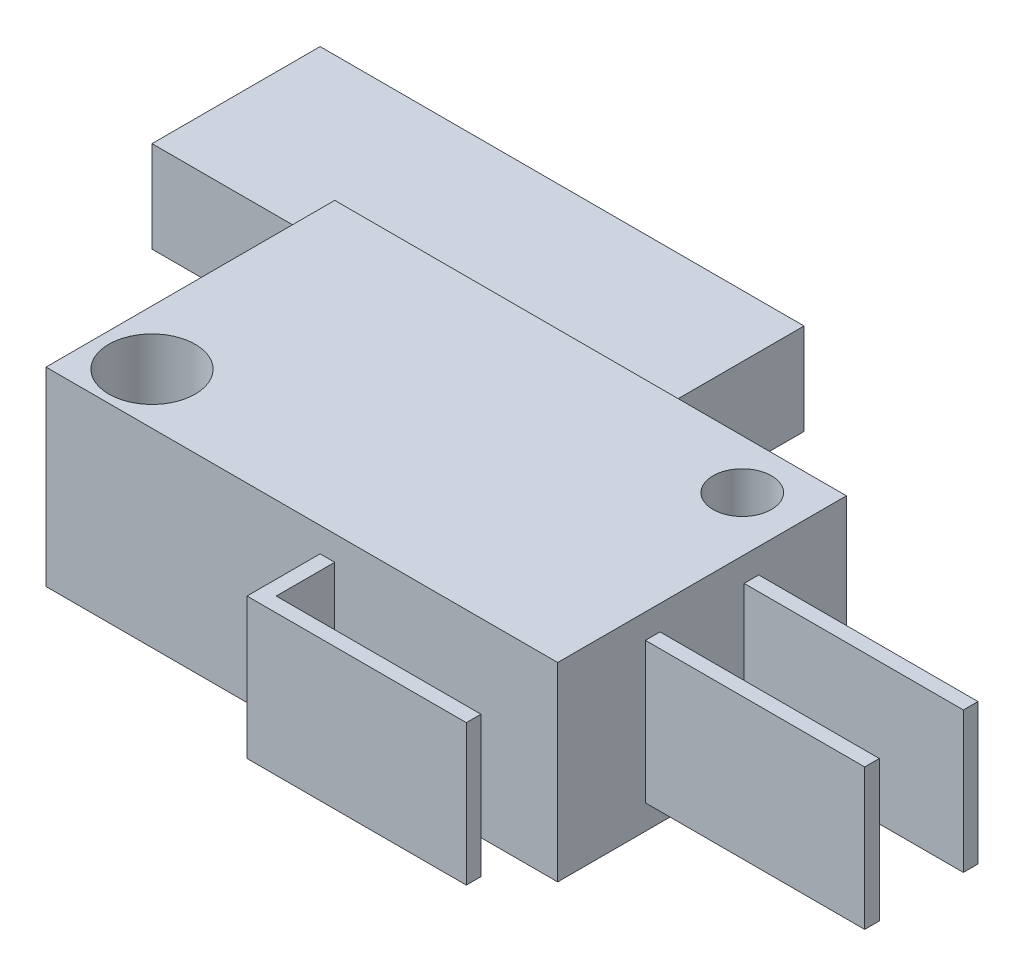
from build123d import *

# Parameters (mm, degrees)
SKETCH1_W                = 28
SKETCH1_H                = 15.8
BASE_DEPTH               = 10.4
SKETCH2_W                = 0.8
SKETCH2_H                = 7.7
END_PRONGS_DEPTH         = 12
SKETCH3_W                = 12
SKETCH3_H                = 7.7
SIDE_PRONG_EXTRUDE_DEPTH = 4
SKETCH4_W                = 11.2
SKETCH4_H                = 3.2
SIDE_PRONG_CUT_DEPTH     = 44.949317401
SKETCH6_R                = 1.6
SKETCH6_R_2              = 2.365004953
HOLES_DEPTH              = 45.247033799
SKETCH5_W                = 16.481894615
SKETCH5_H                = 5
BOSS_EXTRUDE4_DEPTH      = 9.2
SKETCH7_W                = 9.2
SKETCH7_H                = 5
BOSS_EXTRUDE5_DEPTH      = 10


with BuildPart() as part:
    # Sketch1 → Base (new body)
    with BuildSketch(Plane(origin=(0, 0, 0), x_dir=(1, 0, 0), z_dir=(0, 1, 0))):
        with Locations((14, 7.9)):
            Rectangle(SKETCH1_W, SKETCH1_H)
    extrude(amount=BASE_DEPTH)

    # Sketch2 → End Prongs (add)
    with BuildSketch(Plane(origin=(28, 0, 0), x_dir=(0, 0, -1), z_dir=(1, 0, 0))):
        with Locations((5.2, 5.2)):
            Rectangle(SKETCH2_W, SKETCH2_H)
        with Locations((10.6, 5.2)):
            Rectangle(SKETCH2_W, SKETCH2_H)
    extrude(amount=END_PRONGS_DEPTH)

    # Sketch3 → Side Prong Extrude (add)
    with BuildSketch(Plane.XY):
        with Locations((21, 5.2)):
            Rectangle(SKETCH3_W, SKETCH3_H)
    extrude(amount=SIDE_PRONG_EXTRUDE_DEPTH)

    # Sketch4 → Side Prong Cut (cut, through all)
    with BuildSketch(Plane(origin=(0, 9.05, 0), x_dir=(1, 0, 0), z_dir=(0, 1, 0))):
        with Locations((21.4, -1.6)):
            Rectangle(SKETCH4_W, SKETCH4_H)
    extrude(amount=-SIDE_PRONG_CUT_DEPTH, mode=Mode.SUBTRACT)

    # Sketch6 → Holes (cut, through all)
    with BuildSketch(Plane(origin=(0, 10.4, 0), x_dir=(1, 0, 0), z_dir=(0, 1, 0))):
        with Locations(Location((25, 13.1, 0), (0, 0, 270))):
            Circle(SKETCH6_R)
        with Locations(Location((3, 2.8, 0), (0, 0, 270))):
            Circle(SKETCH6_R_2)
    extrude(amount=-HOLES_DEPTH, mode=Mode.SUBTRACT)

    # Sketch5 → Boss-Extrude4 (add)
    with BuildSketch(Plane(origin=(0, 0, -15.8), x_dir=(-1, 0, 0), z_dir=(0, 0, -1))):
        with Locations((-8.240947308, 5.589136769)):
            Rectangle(SKETCH5_W, SKETCH5_H)
    extrude(amount=BOSS_EXTRUDE4_DEPTH)

    # Sketch7 → Boss-Extrude5 (add)
    with BuildSketch(Plane.ZY):
        with Locations((-20.4, 5.589136769)):
            Rectangle(SKETCH7_W, SKETCH7_H)
    extrude(amount=BOSS_EXTRUDE5_DEPTH)


solid = part.part
